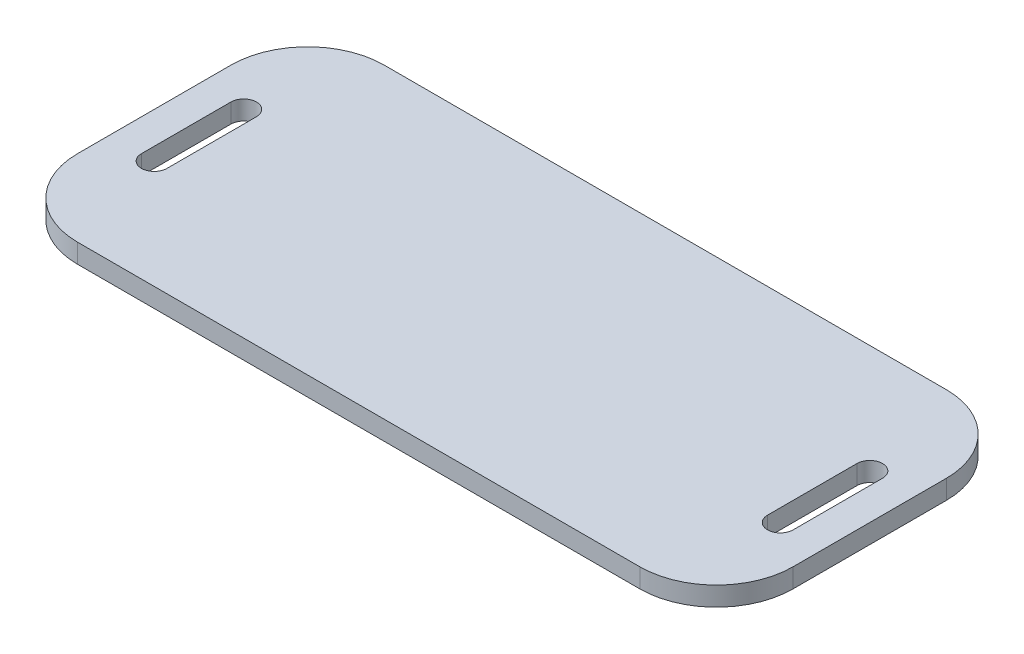
from build123d import *

# Parameters (mm, degrees)
BOSS_EXTRUDE1_DEPTH = 19.05
CUT_EXTRUDE2_DEPTH  = 388.35


with BuildPart() as part:
    # Sketch1 → Boss-Extrude1 (new body)
    with BuildSketch(Plane(origin=(0, 0, 0), x_dir=(1, 0, 0), z_dir=(0, 1, 0))):
        with BuildLine():
            Line((-279.4, 152.4), (279.4, 152.4))
            ThreePointArc((279.4, 152.4), (333.281536726, 130.081536726), (355.6, 76.2))
            Line((355.6, 76.2), (355.6, -76.2))
            ThreePointArc((355.6, -76.2), (333.281536726, -130.081536726), (279.4, -152.4))
            Line((279.4, -152.4), (-279.4, -152.4))
            ThreePointArc((-279.4, -152.4), (-333.281536726, -130.081536726), (-355.6, -76.2))
            Line((-355.6, -76.2), (-355.6, 76.2))
            ThreePointArc((-355.6, 76.2), (-333.281536726, 130.081536726), (-279.4, 152.4))
        make_face()
    extrude(amount=BOSS_EXTRUDE1_DEPTH)

    # Sketch3 → Cut-Extrude2 (cut, through all)
    with BuildSketch(Plane(origin=(0, 19.05, 0), x_dir=(1, 0, 0), z_dir=(0, 1, 0))):
        with BuildLine():
            Line((323.85, 44.45), (323.85, -44.45))
            ThreePointArc((323.85, -44.45), (311.15, -57.15), (298.45, -44.45))
            Line((298.45, -44.45), (298.45, 44.45))
            ThreePointArc((298.45, 44.45), (311.15, 57.15), (323.85, 44.45))
        make_face()
    cut_extrude2 = extrude(amount=-CUT_EXTRUDE2_DEPTH, mode=Mode.SUBTRACT)

    # Mirror1: Cut-Extrude2 across plane
    add(cut_extrude2.mirror(Plane(origin=(0, 0, 0), x_dir=(0, 0, 1), z_dir=(1, 0, 0))), mode=Mode.SUBTRACT)


solid = part.part
